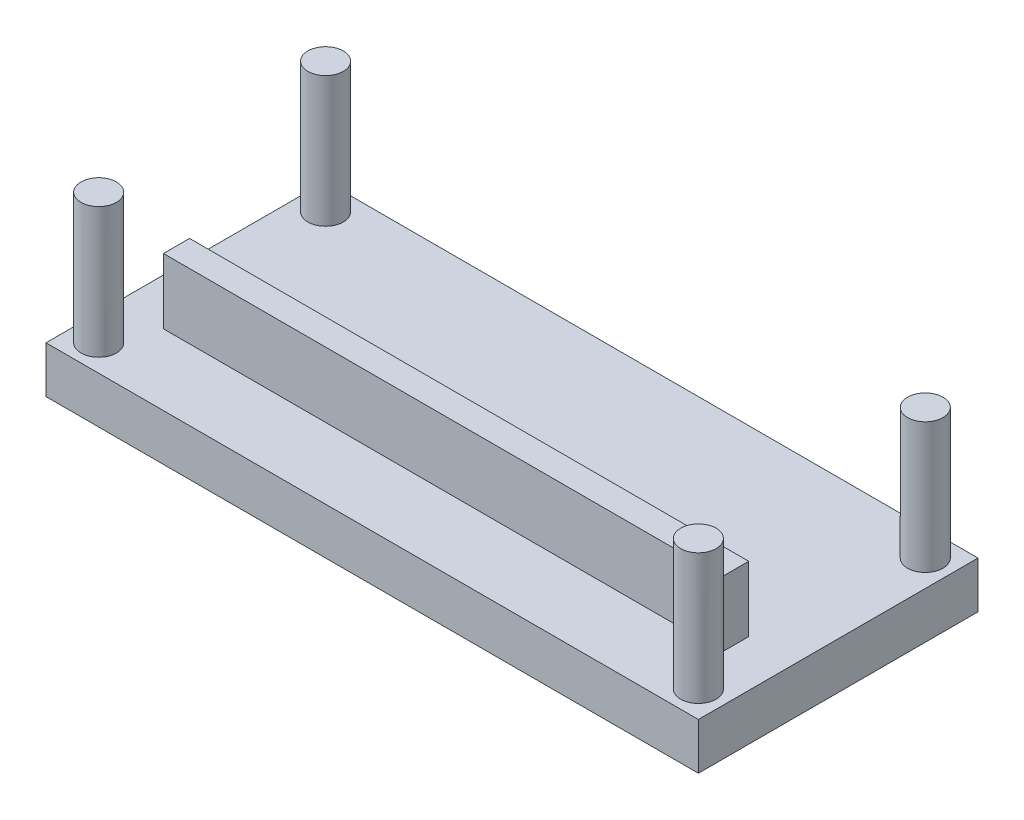
from build123d import *

# Parameters (mm, degrees)
SKETCH1_W           = 70
SKETCH1_H           = 30
BOSS_EXTRUDE1_DEPTH = 15
SKETCH3_W           = 60
SKETCH3_H           = 2.8
BOSS_EXTRUDE3_DEPTH = 7
SKETCH4_W           = 70
SKETCH4_H           = 30
CUT_EXTRUDE1_DEPTH  = 10
SKETCH5_R           = 1.9
BOSS_EXTRUDE4_DEPTH = 14


with BuildPart() as part:
    # Sketch1 → Boss-Extrude1 (new body)
    with BuildSketch(Plane(origin=(0, 0, 0), x_dir=(1, 0, 0), z_dir=(0, 1, 0))):
        with Locations((35, 15)):
            Rectangle(SKETCH1_W, SKETCH1_H)
    extrude(amount=BOSS_EXTRUDE1_DEPTH)

    # Sketch3 → Boss-Extrude3 (add)
    with BuildSketch(Plane(origin=(0, 15, 0), x_dir=(1, 0, 0), z_dir=(0, 1, 0))):
        with Locations((35, 9)):
            Rectangle(SKETCH3_W, SKETCH3_H)
    extrude(amount=BOSS_EXTRUDE3_DEPTH)

    # Sketch4 → Cut-Extrude1 (cut)
    with BuildSketch(Plane(origin=(0, 0, 0), x_dir=(-1, 0, 0), z_dir=(0, -1, 0))):
        with Locations((-35, 15)):
            Rectangle(SKETCH4_W, SKETCH4_H)
    extrude(amount=-CUT_EXTRUDE1_DEPTH, mode=Mode.SUBTRACT)

    # Sketch5 → Boss-Extrude4 (add)
    with BuildSketch(Plane(origin=(0, 15, 0), x_dir=(1, 0, 0), z_dir=(0, 1, 0))):
        with Locations(Location((2.828427125, 2.828427125, 0), (0, 0, 90))):
            Circle(SKETCH5_R)
        with Locations(Location((2.828427125, 27.171572875, 0), (0, 0, 90))):
            Circle(SKETCH5_R)
        with Locations(Location((67.171572875, 27.171572875, 0), (0, 0, 90))):
            Circle(SKETCH5_R)
        with Locations(Location((67.171572875, 2.828427125, 0), (0, 0, 90))):
            Circle(SKETCH5_R)
    extrude(amount=BOSS_EXTRUDE4_DEPTH)


solid = part.part
